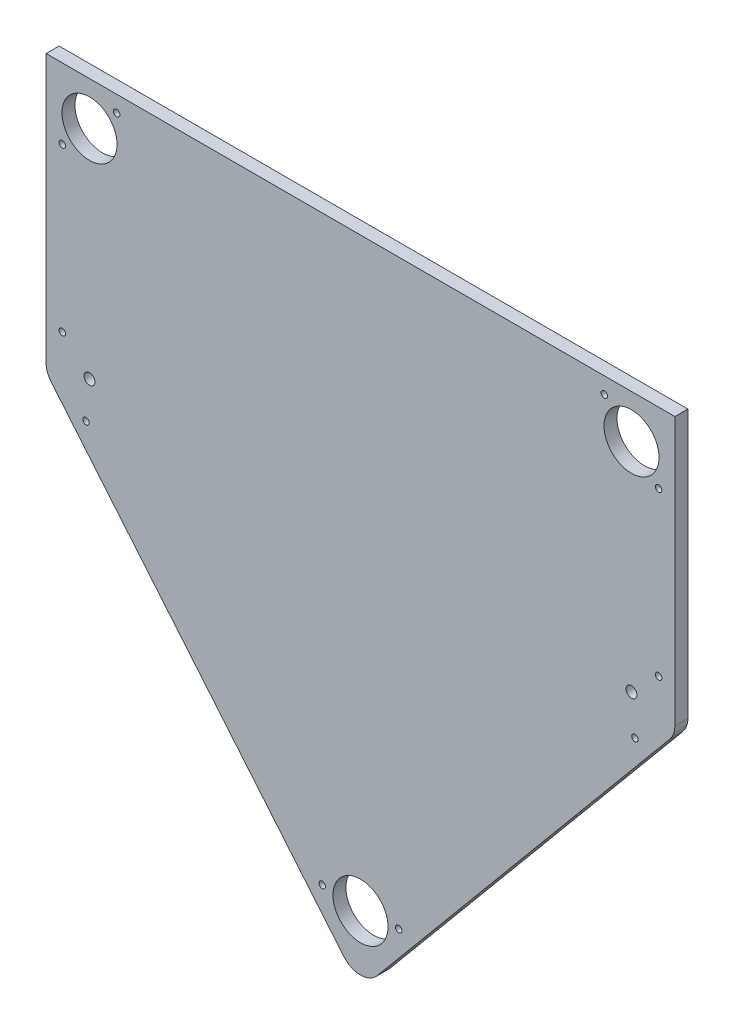
from build123d import *

# Parameters (mm, degrees)
SKETCH1_R           = 12.7
SKETCH1_R_2         = 2.5
SKETCH1_R_3         = 1.5
BOSS_EXTRUDE1_DEPTH = 6
FILLET1_R           = 10


with BuildPart() as part:
    # Sketch1 → Boss-Extrude1 (new body)
    with BuildSketch(Plane.XY):
        Polygon((-145, 120), (145, 120), (145, -7.240998704), (0, -181.240998704), (-145, -7.240998704), align=None)
        with Locations((-125, 100)):
            Circle(SKETCH1_R, mode=Mode.SUBTRACT)
        with Locations((125, 100)):
            Circle(SKETCH1_R, mode=Mode.SUBTRACT)
        with Locations((-125, 0)):
            Circle(SKETCH1_R_2, mode=Mode.SUBTRACT)
        with Locations((125, 0)):
            Circle(SKETCH1_R_2, mode=Mode.SUBTRACT)
        with Locations((0, -150)):
            Circle(SKETCH1_R, mode=Mode.SUBTRACT)
        with Locations((-137.515790027, 87.484209973)):
            Circle(SKETCH1_R_3, mode=Mode.SUBTRACT)
        with Locations((-112.484209973, 112.515790027)):
            Circle(SKETCH1_R_3, mode=Mode.SUBTRACT)
        with Locations((-137.515790027, 12.515790027)):
            Circle(SKETCH1_R_3, mode=Mode.SUBTRACT)
        with Locations((-126.602482705, -17.627309754)):
            Circle(SKETCH1_R_3, mode=Mode.SUBTRACT)
        with Locations((-17.627309754, -148.397517295)):
            Circle(SKETCH1_R_3, mode=Mode.SUBTRACT)
        with Locations(Location((17.627309754, -148.397517295, 0), (0, 0, 180))):
            Circle(SKETCH1_R_3, mode=Mode.SUBTRACT)
        with Locations(Location((126.602482705, -17.627309754, 0), (0, 0, 180))):
            Circle(SKETCH1_R_3, mode=Mode.SUBTRACT)
        with Locations(Location((137.515790027, 12.515790027, 0), (0, 0, 180))):
            Circle(SKETCH1_R_3, mode=Mode.SUBTRACT)
        with Locations(Location((137.515790027, 87.484209973, 0), (0, 0, 180))):
            Circle(SKETCH1_R_3, mode=Mode.SUBTRACT)
        with Locations(Location((112.484209973, 112.515790027, 0), (0, 0, 180))):
            Circle(SKETCH1_R_3, mode=Mode.SUBTRACT)
    extrude(amount=BOSS_EXTRUDE1_DEPTH)

    # Fillet1
    fillet1_edges = [part.edges().sort_by_distance(p)[0] for p in [
        (145, -7.240998704, 3),
        (0, -181.240998704, 3),
        (-145, -7.240998704, 3),
    ]]
    fillet(fillet1_edges, radius=FILLET1_R)


solid = part.part
